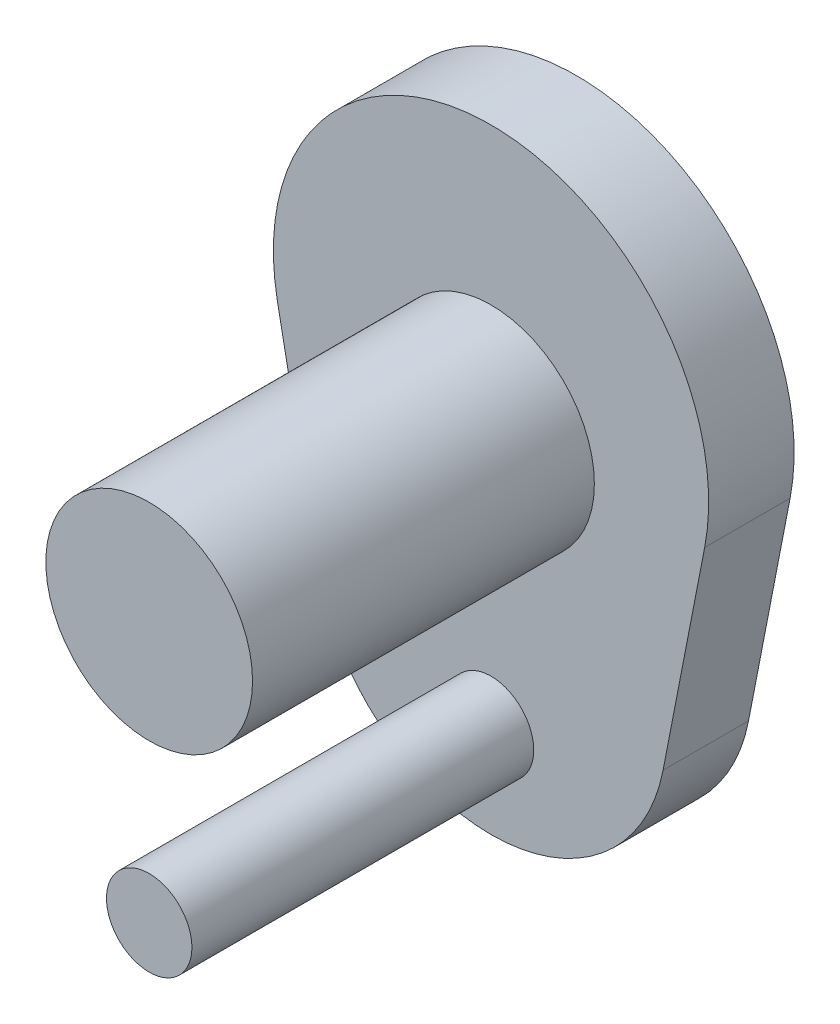
from build123d import *

# Parameters (mm, degrees)
SKETCH1_R           = 15.359074057
BOSS_EXTRUDE1_DEPTH = 50.8
BOSS_EXTRUDE2_DEPTH = 12.7
SKETCH3_R           = 6.35
BOSS_EXTRUDE3_DEPTH = 50.8


with BuildPart() as part:
    # Sketch1 → Boss-Extrude1 (new body)
    with BuildSketch(Plane.XY):
        Circle(SKETCH1_R)
    extrude(amount=BOSS_EXTRUDE1_DEPTH)

    # Sketch2 → Boss-Extrude2 (add)
    with BuildSketch(Plane(origin=(0, 0, 0), x_dir=(-1, 0, 0), z_dir=(0, 0, -1))):
        with BuildLine():
            Line((-31.75, 0), (-25.57013776, -31.75))
            ThreePointArc((-25.57013776, -31.75), (0, -52.822994947), (25.57013776, -31.75))
            Line((25.57013776, -31.75), (31.75, 0))
            ThreePointArc((31.75, 0), (0, 38.525699643), (-31.75, 0))
        make_face()
    extrude(amount=BOSS_EXTRUDE2_DEPTH)

    # Sketch3 → Boss-Extrude3 (add)
    with BuildSketch(Plane.XY):
        with Locations((0, -38.777693264)):
            Circle(SKETCH3_R)
    extrude(amount=BOSS_EXTRUDE3_DEPTH)


solid = part.part
